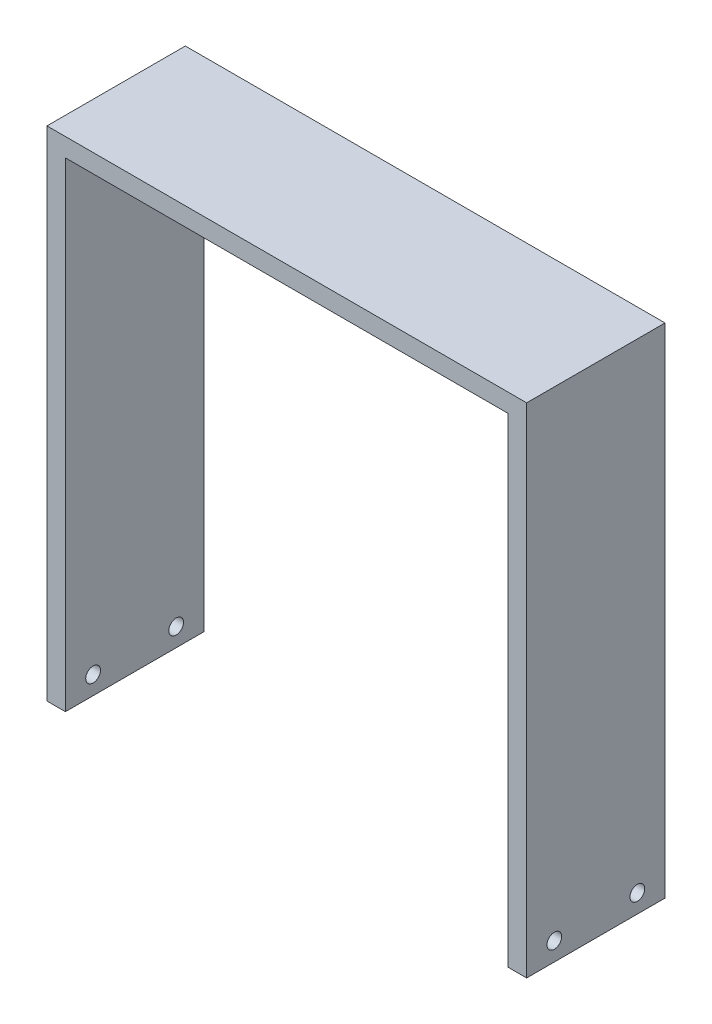
from build123d import *

# Parameters (mm, degrees)
BOSS_EXTRUDE1_DEPTH   = 15
M2_TAPPED_HOLE1_D     = 1.6
M2_TAPPED_HOLE1_DEPTH = 49.999
MIRROR2_COPY_1_D      = 1.6
MIRROR2_COPY_1_DEPTH  = 49.999


with BuildPart() as part:
    # Sketch1 → Boss-Extrude1 (new body)
    with BuildSketch(Plane.XY):
        Polygon((0, 0), (0, 54), (52, 54), (52, 0), (50, 0), (50, 52), (2, 52), (2, 0), align=None)
    extrude(amount=BOSS_EXTRUDE1_DEPTH)

    # M2 Tapped Hole1
    with Locations(Plane(origin=(52, 0, 0), x_dir=(0, 0, -1), z_dir=(1, 0, 0))):
        with Locations((-12, 2)):
            m2_tapped_hole1 = Hole(M2_TAPPED_HOLE1_D / 2, depth=M2_TAPPED_HOLE1_DEPTH)

    # Mirror1: M2 Tapped Hole1 across plane
    add(m2_tapped_hole1.mirror(Plane.XY.offset(7.5)), mode=Mode.SUBTRACT)

    # Mirror2: M2 Tapped Hole1 across plane
    add(m2_tapped_hole1.mirror(Plane(origin=(26, 0, 0), x_dir=(0, 0, 1), z_dir=(1, 0, 0))), mode=Mode.SUBTRACT)

    # Mirror2 copy 1
    with Locations(Plane(origin=(0, 0, 15), x_dir=(0, 0, 1), z_dir=(-1, 0, 0))):
        with Locations((-12, 2)):
            Hole(MIRROR2_COPY_1_D / 2, depth=MIRROR2_COPY_1_DEPTH)


solid = part.part
